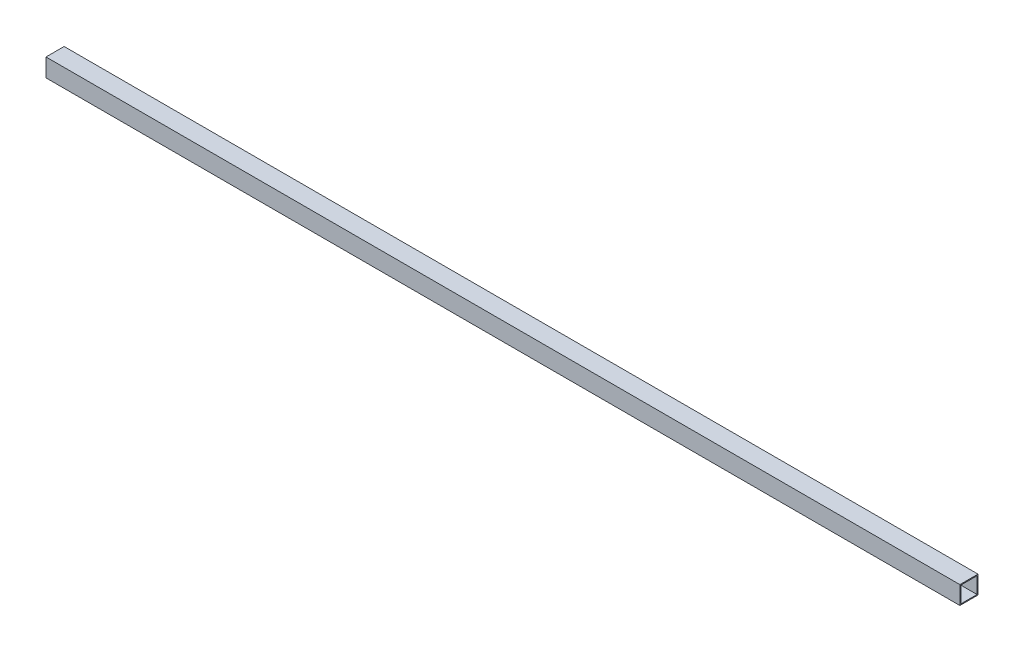
from build123d import *

# Parameters (mm, degrees)
SKETCH1_W           = 19.05
SKETCH1_H           = 19.05
SKETCH1_W_2         = 17.05
SKETCH1_H_2         = 17.05
BOSS_EXTRUDE1_DEPTH = 960


with BuildPart() as part:
    # Sketch1 → Boss-Extrude1 (new body)
    with BuildSketch(Plane(origin=(0, 0, 0), x_dir=(0, 0, -1), z_dir=(1, 0, 0))):
        Rectangle(SKETCH1_W, SKETCH1_H)
        Rectangle(SKETCH1_W_2, SKETCH1_H_2, mode=Mode.SUBTRACT)
    extrude(amount=BOSS_EXTRUDE1_DEPTH)


solid = part.part
